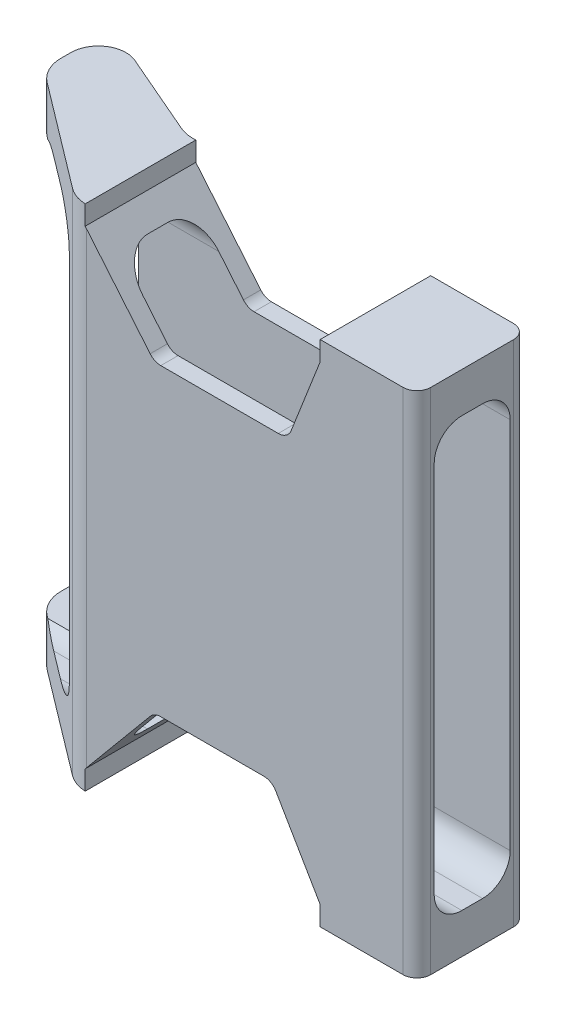
from build123d import *

# Parameters (mm, degrees)
SKETCH1_W               = 34
SKETCH1_H               = 12
BOSS_EXTRUDE1_DEPTH     = 34.00000007
CUT_EXTRUDE_THIN1_DEPTH = 49.456165807
CUT_EXTRUDE1_DEPTH      = 2
SKETCH5_W               = 8.508301653
SKETCH5_H               = 30.00000007
CUT_EXTRUDE2_DEPTH      = 1
CUT_EXTRUDE3_DEPTH      = 50.315688701
CUT_EXTRUDE4_DEPTH      = 49.456165807
BOSS_EXTRUDE2_START     = 1.4
BOSS_EXTRUDE2_DEPTH     = 1.4


with BuildPart() as part:
    # Sketch1 → Boss-Extrude1 (new body)
    with BuildSketch(Plane(origin=(0, 0, 0), x_dir=(1, 0, 0), z_dir=(0, 1, 0))):
        with Locations((17, 0)):
            Rectangle(SKETCH1_W, SKETCH1_H)
    extrude(amount=BOSS_EXTRUDE1_DEPTH)

    # Sketch2 → Cut-Extrude-Thin1 (cut, through all)
    with BuildSketch(Plane.XZ):
        with BuildLine():
            Line((33, -9.62), (10.827001263, -9.62))
            Line((10.827001263, -9.62), (5.81828527, -11.78593124))
            ThreePointArc((5.81828527, -11.78593124), (-3.282636449, -10.995932133), (-7.62, -2.956146555))
            Line((-7.62, -2.956146555), (-7.62, -2.263164725))
            ThreePointArc((-7.62, -2.263164725), (-6.557151524, 2.260930118), (-3.590977529, 5.838484153))
            Line((-3.590977529, 5.838484153), (3.971775857, 11.561648878))
            ThreePointArc((3.971775857, 11.561648878), (6.869113997, 13.091675675), (10.102753387, 13.62))
            Line((10.102753387, 13.62), (33, 13.62))
            ThreePointArc((33, 13.62), (39.095260454, 11.095260454), (41.62, 5))
            Line((41.62, 5), (41.62, -1))
            ThreePointArc((41.62, -1), (39.095260454, -7.095260454), (33, -9.62))
        make_face()
        with BuildLine():
            Line((33, -2), (9.775667088, -2))
            ThreePointArc((9.775667088, -2), (9.260908141, -2.052707652), (8.767512765, -2.208643129))
            Line((8.767512765, -2.208643129), (2.793822301, -4.791860626))
            ThreePointArc((2.793822301, -4.791860626), (0.901738784, -4.627619648), (0, -2.956146555))
            Line((0, -2.956146555), (0, -2.263164725))
            ThreePointArc((0, -2.263164725), (0.265712119, -1.132141014), (1.007255618, -0.237752506))
            Line((1.007255618, -0.237752506), (8.570009004, 5.485412219))
            ThreePointArc((8.570009004, 5.485412219), (9.294343539, 5.867918919), (10.102753387, 6))
            Line((10.102753387, 6), (33, 6))
            ThreePointArc((33, 6), (33.707106781, 5.707106781), (34, 5))
            Line((34, 5), (34, -1))
            ThreePointArc((34, -1), (33.707106781, -1.707106781), (33, -2))
        make_face(mode=Mode.SUBTRACT)
    extrude(amount=-CUT_EXTRUDE_THIN1_DEPTH, mode=Mode.SUBTRACT)

    # Sketch3 → Cut-Extrude1 (cut)
    with BuildSketch(Plane(origin=(0.481189039, 0, -0.635856944), x_dir=(0.7974063856023161, 0, 0.6034426701855364), z_dir=(-0.6034426701855365, 0, 0.7974063856023162))):
        with BuildLine():
            Line((-2.189052199, 32.00000007), (7.310947801, 32.00000007))
            ThreePointArc((7.310947801, 32.00000007), (8.018054582, 31.707106851), (8.310947801, 31.00000007))
            Line((8.310947801, 31.00000007), (8.310947801, 3))
            ThreePointArc((8.310947801, 3), (8.018054582, 2.292893219), (7.310947801, 2))
            Line((7.310947801, 2), (-2.189052199, 2))
            Line((-2.189052199, 2), (-2.189052199, 32.00000007))
        make_face()
    extrude(amount=-CUT_EXTRUDE1_DEPTH, mode=Mode.SUBTRACT)

    # Sketch5 → Cut-Extrude2 (cut)
    with BuildSketch(Plane(origin=(2.185846154, 0, -5.054769231), x_dir=(-0.9178570359601427, 0, -0.39691115068546684), z_dir=(0.39691115068546684, 0, -0.9178570359601427))):
        with Locations((-2.916537368, 17.000000035)):
            Rectangle(SKETCH5_W, SKETCH5_H)
    extrude(amount=-CUT_EXTRUDE2_DEPTH, mode=Mode.SUBTRACT)

    # Sketch6 → Cut-Extrude3 (cut, through all)
    with BuildSketch(Plane.XY.offset(6)):
        with BuildLine():
            Line((5.108391885, 32.00000007), (6.108391885, 32.00000007))
            ThreePointArc((6.108391885, 32.00000007), (6.815498667, 31.707106851), (7.108391885, 31.00000007))
            Line((7.108391885, 31.00000007), (7.108391885, 3))
            ThreePointArc((7.108391885, 3), (6.815498667, 2.292893219), (6.108391885, 2))
            Line((6.108391885, 2), (5.108391885, 2))
            ThreePointArc((5.108391885, 2), (4.401285104, 2.292893219), (4.108391885, 3))
            Line((4.108391885, 3), (4.108391885, 31.00000007))
            ThreePointArc((4.108391885, 31.00000007), (4.401285104, 31.707106851), (5.108391885, 32.00000007))
        make_face()
        with BuildLine():
            Line((10, 34.00000007), (27, 34.00000007))
            Line((27, 34.00000007), (24.899542929, 28.635409633))
            ThreePointArc((24.899542929, 28.635409633), (24.532028014, 28.173988436), (23.968374946, 28.00000007))
            Line((23.968374946, 28.00000007), (15.468374946, 28.00000007))
            ThreePointArc((15.468374946, 28.00000007), (15.04421955, 28.094410649), (14.700153666, 28.35981567))
            Line((14.700153666, 28.35981567), (10, 34.00000007))
        make_face()
        with BuildLine():
            Line((10, 0), (14.700153666, 5.6401844))
            ThreePointArc((14.700153666, 5.6401844), (15.04421955, 5.905589421), (15.468374946, 6))
            Line((15.468374946, 6), (22.925629668, 6))
            ThreePointArc((22.925629668, 6), (23.423690394, 5.867142153), (23.789408568, 5.503871026))
            Line((23.789408568, 5.503871026), (27, 0))
            Line((27, 0), (10, 0))
        make_face()
    extrude(amount=-CUT_EXTRUDE3_DEPTH, mode=Mode.SUBTRACT)

    # Sketch7 → Cut-Extrude4 (cut, through all)
    with BuildSketch(Plane(origin=(34, 0, 0), x_dir=(0, 0, -1), z_dir=(1, 0, 0))):
        with BuildLine():
            Line((-2.75, 32.50000007), (-1.25, 32.50000007))
            ThreePointArc((-1.25, 32.50000007), (0.164213562, 31.914213632), (0.75, 30.50000007))
            Line((0.75, 30.50000007), (0.75, 3.5))
            ThreePointArc((0.75, 3.5), (0.164213562, 2.085786438), (-1.25, 1.5))
            Line((-1.25, 1.5), (-2.75, 1.5))
            ThreePointArc((-2.75, 1.5), (-4.164213562, 2.085786438), (-4.75, 3.5))
            Line((-4.75, 3.5), (-4.75, 30.50000007))
            ThreePointArc((-4.75, 30.50000007), (-4.164213562, 31.914213632), (-2.75, 32.50000007))
        make_face()
    extrude(amount=-CUT_EXTRUDE4_DEPTH, mode=Mode.SUBTRACT)

    # Sketch8 → Boss-Extrude2 (add)
    with BuildSketch(Plane.XZ.offset(BOSS_EXTRUDE2_START)):
        with BuildLine():
            Line((27, 6), (27, -2))
            Line((27, -2), (33, -2))
            ThreePointArc((33, -2), (33.707106781, -1.707106781), (34, -1))
            Line((34, -1), (34, 5))
            ThreePointArc((34, 5), (33.707106781, 5.707106781), (33, 6))
            Line((33, 6), (27, 6))
        make_face()
        with BuildLine():
            Line((10, -2), (10, 5.997920752))
            ThreePointArc((10, 5.997920752), (9.245793944, 5.851070997), (8.570009004, 5.485412219))
            Line((8.570009004, 5.485412219), (1.007255618, -0.237752506))
            ThreePointArc((1.007255618, -0.237752506), (0.265712119, -1.132141014), (0, -2.263164725))
            Line((0, -2.263164725), (0, -2.956146555))
            ThreePointArc((0, -2.956146555), (0.901738784, -4.627619648), (2.793822301, -4.791860626))
            Line((2.793822301, -4.791860626), (8.767512765, -2.208643129))
            ThreePointArc((8.767512765, -2.208643129), (9.260908141, -2.052707652), (9.775667088, -2))
            Line((9.775667088, -2), (10, -2))
        make_face()
    boss_extrude2 = extrude(amount=-BOSS_EXTRUDE2_DEPTH)

    # Mirror1: Boss-Extrude2 across plane
    add(boss_extrude2.mirror(Plane(origin=(0, 17.000000035, 0), x_dir=(0, 0, 1), z_dir=(0, -1, 0))))


solid = part.part
